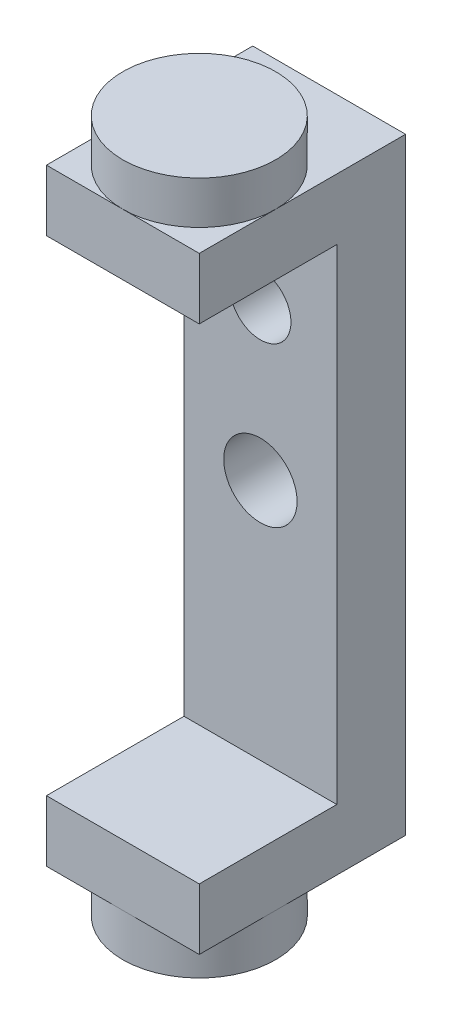
from build123d import *

# Parameters (mm, degrees)
SKETCH_1_W      = 5
SKETCH_1_H      = 19.865848542
SKETCH_1_R      = 1.200000017
SKETCH_1_R_2    = 1.000000001
EXTRUDE_1_DEPTH = 2.25
SKETCH_2_W      = 5
SKETCH_2_H      = 2
EXTRUDE_2_DEPTH = 4.5
SKETCH_3_R      = 2.5
EXTRUDE_3_DEPTH = 1.4


with BuildPart() as part:
    # 草图1 → 凸台-拉伸1 (new body)
    with BuildSketch(Plane.XY):
        Rectangle(SKETCH_1_W, SKETCH_1_H)
        with Locations((-3.5e-08, -2.5e-08)):
            Circle(SKETCH_1_R, mode=Mode.SUBTRACT)
        with Locations((1.04e-07, 4.982520103)):
            Circle(SKETCH_1_R_2, mode=Mode.SUBTRACT)
    extrude(amount=EXTRUDE_1_DEPTH)

    # 草图2 → 凸台-拉伸2 (add)
    with BuildSketch(Plane.XY.offset(2.25)):
        with Locations((0, 8.932924271)):
            Rectangle(SKETCH_2_W, SKETCH_2_H)
        with Locations((0, -8.932924271)):
            Rectangle(SKETCH_2_W, SKETCH_2_H)
    extrude(amount=EXTRUDE_2_DEPTH)

    # 草图3 → 凸台-拉伸3 (add)
    with BuildSketch(Plane(origin=(0, 9.932924271, 0), x_dir=(1, 0, 0), z_dir=(0, 1, 0))):
        with Locations((0, -4.25)):
            Circle(SKETCH_3_R)
    extrude_3 = extrude(amount=EXTRUDE_3_DEPTH)

    # 镜向1: 凸台-拉伸3 across plane
    add(extrude_3.mirror(Plane.ZX))


solid = part.part
